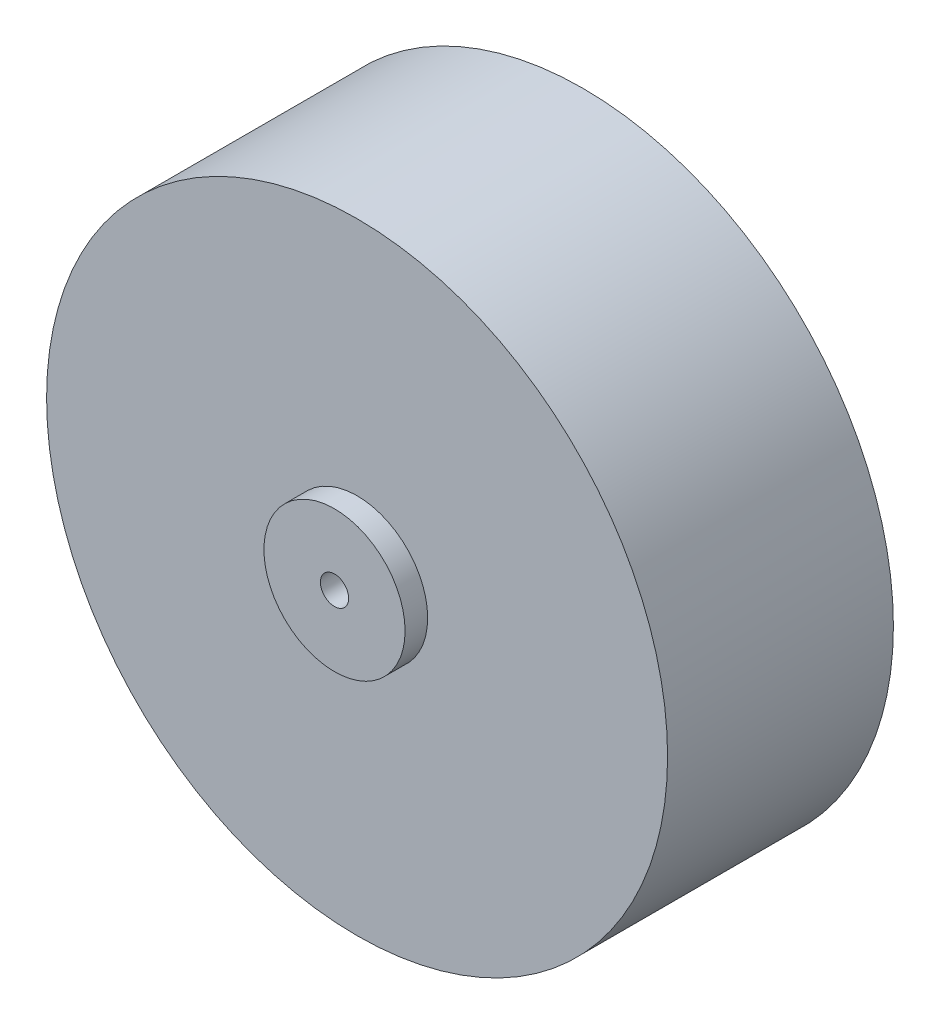
from build123d import *

# Parameters (mm, degrees)
SKETCH1_R           = 55
BOSS_EXTRUDE1_DEPTH = 20
SKETCH2_R           = 12.5
BOSS_EXTRUDE2_DEPTH = 4
KEYWAY_DEPTH        = 97.269852921


with BuildPart() as part:
    # Sketch1 → Boss-Extrude1 (new, symmetric)
    with BuildSketch(Plane.XY):
        Circle(SKETCH1_R)
    extrude(amount=BOSS_EXTRUDE1_DEPTH, both=True)

    # Sketch2 → Boss-Extrude2 (add)
    with BuildSketch(Plane.XY.offset(20)):
        Circle(SKETCH2_R)
    boss_extrude2 = extrude(amount=BOSS_EXTRUDE2_DEPTH)

    # Mirror1: Boss-Extrude2 across plane
    add(boss_extrude2.mirror(Plane.XY))

    # KeySketch → Keyway (cut, through all)
    with BuildSketch(Plane(origin=(6.62471706, 1.269697251, 24), x_dir=(1, 0, 0), z_dir=(0, 0, 1))):
        with BuildLine():
            ThreePointArc((-7.62471706, 1.021590597), (-6.62471706, -3.769697251), (-5.62471706, 1.021590597))
            ThreePointArc((-5.62471706, 1.021590597), (-6.62471706, 1.230302749), (-7.62471706, 1.021590597))
        make_face()
    extrude(amount=-KEYWAY_DEPTH, mode=Mode.SUBTRACT)


solid = part.part
